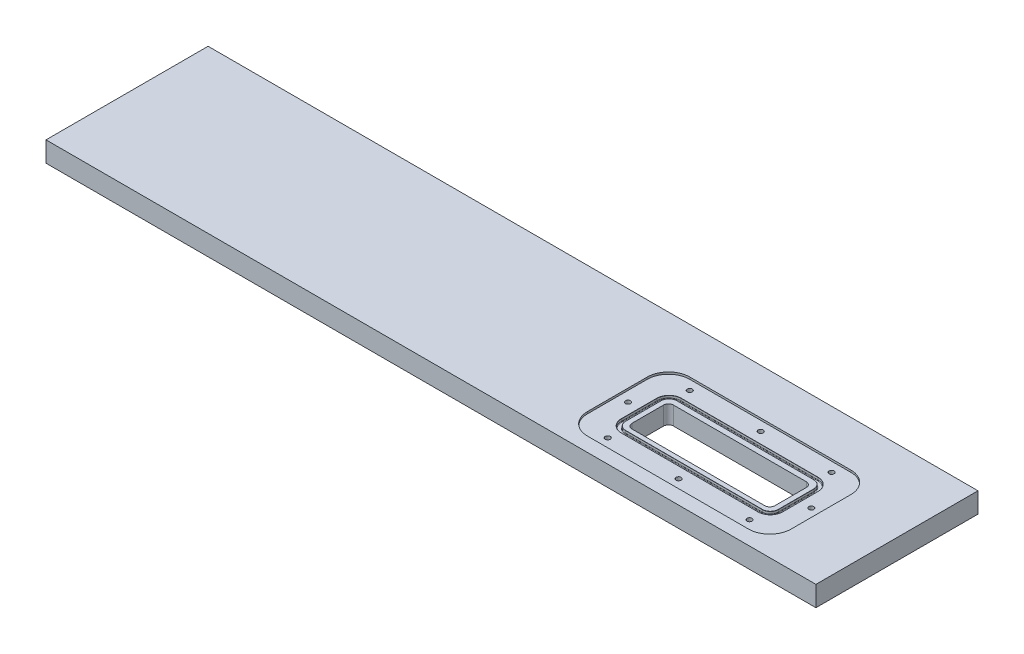
from build123d import *

# Parameters (mm, degrees)
SKETCH_1_W                  = 760
SKETCH_1_H                  = 160
EXTRUDE_1_DEPTH             = 10
SKETCH_2_R                  = 19
CUT_EXTRUDE_1_DEPTH         = 777.916983982
CUT_EXTRUDE_2_DEPTH         = 2
CUT_EXTRUDE_4_DEPTH         = 2.7
CUT_EXTRUDE_5_DEPTH         = 777.868071168
HOLE_WIZARD_M6_1_AT_2_COUNT = 2
HOLE_WIZARD_M6_1_AT_2_PITCH = 70
HOLE_WIZARD_M6_1_AT_3_COUNT = 2
HOLE_WIZARD_M6_1_AT_3_PITCH = 140
HOLE_WIZARD_M6_1_AT_4_COUNT = 2
HOLE_WIZARD_M6_1_AT_4_PITCH = 161.743624295
HOLE_WIZARD_M6_1_AT_5_COUNT = 2
HOLE_WIZARD_M6_1_AT_5_PITCH = 107.056060081
HOLE_WIZARD_M6_1_AT_6_COUNT = 2
HOLE_WIZARD_M6_1_AT_6_PITCH = 81
HOLE_WIZARD_M6_1_AT_7_COUNT = 2
HOLE_WIZARD_M6_1_AT_7_PITCH = 45.392730696
HOLE_WIZARD_M6_1_AT_8_COUNT = 2
HOLE_WIZARD_M6_1_AT_8_PITCH = 165.530963871
FILLET_1_R                  = 0.13
FILLET_2_R                  = 0.5
FILLET_3_R                  = 0.5
FILLET_4_R                  = 0.13
SKETCH_8_W                  = 211.597975829
SKETCH_8_H                  = 104.563980274
EXTRUDE_3_DEPTH             = 20
FILLET_1_OF_MIRROR_2_R      = 0.13
FILLET_2_OF_MIRROR_2_R      = 0.5
FILLET_3_OF_MIRROR_2_R      = 0.5
FILLET_4_OF_MIRROR_2_R      = 0.13
SKETCH_9_W                  = 824.574346591
SKETCH_9_H                  = 126.258075754
CUT_EXTRUDE_6_DEPTH         = 777.723889165


with BuildPart() as part:
    # 스케치1 → 보스-돌출1 (new, symmetric)
    with BuildSketch(Plane(origin=(0, 0, 0), x_dir=(1, 0, 0), z_dir=(0, 1, 0))):
        with Locations((380, 80)):
            Rectangle(SKETCH_1_W, SKETCH_1_H)
    extrude_1 = extrude(amount=EXTRUDE_1_DEPTH, both=True)

    # 스케치2 → 컷-돌출1 (cut, through all)
    with BuildSketch(Plane(origin=(0, 10, 0), x_dir=(1, 0, 0), z_dir=(0, 1, 0))):
        with Locations(Location((280, 80, 0), (0, 0, 270))):
            Circle(SKETCH_2_R)
        with Locations(Location((380, 80, 0), (0, 0, 270))):
            Circle(SKETCH_2_R)
    cut_extrude_1 = extrude(amount=-CUT_EXTRUDE_1_DEPTH, mode=Mode.SUBTRACT)

    # 스케치3 → 컷-돌출2 (cut)
    with BuildSketch(Plane(origin=(0, 10, 0), x_dir=(1, 0, 0), z_dir=(0, 1, 0))):
        with BuildLine():
            Line((520.5, 146), (679.5, 146))
            ThreePointArc((679.5, 146), (694.349242405, 139.849242405), (700.5, 125))
            Line((700.5, 125), (700.5, 66))
            ThreePointArc((700.5, 66), (694.349242405, 51.150757595), (679.5, 45))
            Line((679.5, 45), (520.5, 45))
            ThreePointArc((520.5, 45), (505.650757595, 51.150757595), (499.5, 66))
            Line((499.5, 66), (499.5, 125))
            ThreePointArc((499.5, 125), (505.650757595, 139.849242405), (520.5, 146))
        make_face()
    cut_extrude_2 = extrude(amount=-CUT_EXTRUDE_2_DEPTH, mode=Mode.SUBTRACT)

    # 스케치4 → 컷-돌출4 (cut)
    with BuildSketch(Plane(origin=(0, 8, 0), x_dir=(1, 0, 0), z_dir=(0, 1, 0))):
        with BuildLine():
            Line((532.5, 124.55), (667.5, 124.55))
            ThreePointArc((667.5, 124.55), (676.020636713, 121.020636713), (679.55, 112.5))
            Line((679.55, 112.5), (679.55, 77.5))
            ThreePointArc((679.55, 77.5), (676.020636713, 68.979363287), (667.5, 65.45))
            Line((667.5, 65.45), (532.5, 65.45))
            ThreePointArc((532.5, 65.45), (523.979363287, 68.979363287), (520.45, 77.5))
            Line((520.45, 77.5), (520.45, 112.5))
            ThreePointArc((520.45, 112.5), (523.979363287, 121.020636713), (532.5, 124.55))
        make_face()
        with BuildLine():
            Line((532.5, 120.45), (667.5, 120.45))
            ThreePointArc((667.5, 120.45), (673.12149891, 118.12149891), (675.45, 112.5))
            Line((675.45, 112.5), (675.45, 77.5))
            ThreePointArc((675.45, 77.5), (673.12149891, 71.87850109), (667.5, 69.55))
            Line((667.5, 69.55), (532.5, 69.55))
            ThreePointArc((532.5, 69.55), (526.87850109, 71.87850109), (524.55, 77.5))
            Line((524.55, 77.5), (524.55, 112.5))
            ThreePointArc((524.55, 112.5), (526.87850109, 118.12149891), (532.5, 120.45))
        make_face(mode=Mode.SUBTRACT)
    cut_extrude_4 = extrude(amount=-CUT_EXTRUDE_4_DEPTH, mode=Mode.SUBTRACT)

    # 스케치5 → 컷-돌출5 (cut, through all)
    with BuildSketch(Plane(origin=(0, 8, 0), x_dir=(1, 0, 0), z_dir=(0, 1, 0))):
        with BuildLine():
            Line((534.5, 116), (665.5, 116))
            ThreePointArc((665.5, 116), (669.035533906, 114.535533906), (670.5, 111))
            Line((670.5, 111), (670.5, 80))
            ThreePointArc((670.5, 80), (669.035533906, 76.464466094), (665.5, 75))
            Line((665.5, 75), (534.5, 75))
            ThreePointArc((534.5, 75), (530.964466094, 76.464466094), (529.5, 80))
            Line((529.5, 80), (529.5, 111))
            ThreePointArc((529.5, 111), (530.964466094, 114.535533906), (534.5, 116))
        make_face()
    cut_extrude_5 = extrude(amount=-CUT_EXTRUDE_5_DEPTH, mode=Mode.SUBTRACT)

    # 스케치7 → M6 나사 구멍1 (revolve, cut)
    with BuildSketch(Plane(origin=(530, 8, -135.5), x_dir=(0, 0, 1), z_dir=(1, 0, 0))):
        Polygon((0, 0), (0, 16.502151548), (2.5, 15), (2.5, 0), align=None)
    hole_wizard_m6_1 = revolve(axis=Axis((530, 14.35, -135.5), (0, -1, 0)), mode=Mode.SUBTRACT)

    # M6 나사 구멍1 at 2: M6 나사 구멍1 ×2
    with Locations(*[(i * HOLE_WIZARD_M6_1_AT_2_PITCH, 0, 0) for i in range(1, HOLE_WIZARD_M6_1_AT_2_COUNT)]):
        add(hole_wizard_m6_1, mode=Mode.SUBTRACT)

    # M6 나사 구멍1 at 3: M6 나사 구멍1 ×2
    with Locations(*[(i * HOLE_WIZARD_M6_1_AT_3_PITCH, 0, 0) for i in range(1, HOLE_WIZARD_M6_1_AT_3_COUNT)]):
        add(hole_wizard_m6_1, mode=Mode.SUBTRACT)

    # M6 나사 구멍1 at 4: M6 나사 구멍1 ×2
    with Locations(*[Vector(0.8655673483912874, 0, 0.5007925372835301) * (i * HOLE_WIZARD_M6_1_AT_4_PITCH) for i in range(1, HOLE_WIZARD_M6_1_AT_4_COUNT)]):
        add(hole_wizard_m6_1, mode=Mode.SUBTRACT)

    # M6 나사 구멍1 at 5: M6 나사 구멍1 ×2
    with Locations(*[Vector(0.6538630316419342, 0, 0.7566129366142368) * (i * HOLE_WIZARD_M6_1_AT_5_PITCH) for i in range(1, HOLE_WIZARD_M6_1_AT_5_COUNT)]):
        add(hole_wizard_m6_1, mode=Mode.SUBTRACT)

    # M6 나사 구멍1 at 6: M6 나사 구멍1 ×2
    with Locations(*[(0, 0, i * HOLE_WIZARD_M6_1_AT_6_PITCH) for i in range(1, HOLE_WIZARD_M6_1_AT_6_COUNT)]):
        add(hole_wizard_m6_1, mode=Mode.SUBTRACT)

    # M6 나사 구멍1 at 7: M6 나사 구멍1 ×2
    with Locations(*[Vector(-0.45161416125166726, 0, 0.8922133429606134) * (i * HOLE_WIZARD_M6_1_AT_7_PITCH) for i in range(1, HOLE_WIZARD_M6_1_AT_7_COUNT)]):
        add(hole_wizard_m6_1, mode=Mode.SUBTRACT)

    # M6 나사 구멍1 at 8: M6 나사 구멍1 ×2
    with Locations(*[Vector(0.9696071130550645, 0, 0.24466721544380116) * (i * HOLE_WIZARD_M6_1_AT_8_PITCH) for i in range(1, HOLE_WIZARD_M6_1_AT_8_COUNT)]):
        add(hole_wizard_m6_1, mode=Mode.SUBTRACT)

    # 필렛1
    fillet_1_edges = [part.edges().sort_by_distance(p)[0] for p in [
        (523.979363287, 8, -121.020636713),
        (520.45, 8, -95),
        (523.979363287, 8, -68.979363287),
        (600, 8, -65.45),
        (676.020636713, 8, -68.979363287),
        (679.55, 8, -95),
        (676.020636713, 8, -121.020636713),
        (600, 8, -124.55),
    ]]
    fillet(fillet_1_edges, radius=FILLET_1_R)

    # 필렛2
    fillet_2_edges = [part.edges().sort_by_distance(p)[0] for p in [
        (523.979363287, 5.3, -121.020636713),
        (600, 5.3, -124.55),
        (676.020636713, 5.3, -121.020636713),
        (679.55, 5.3, -95),
        (676.020636713, 5.3, -68.979363287),
        (600, 5.3, -65.45),
        (523.979363287, 5.3, -68.979363287),
        (520.45, 5.3, -95),
    ]]
    fillet(fillet_2_edges, radius=FILLET_2_R)

    # 필렛3
    fillet_3_edges = [part.edges().sort_by_distance(p)[0] for p in [
        (675.45, 5.3, -95),
        (673.12149891, 5.3, -118.12149891),
        (600, 5.3, -120.45),
        (526.87850109, 5.3, -118.12149891),
        (524.55, 5.3, -95),
        (526.87850109, 5.3, -71.87850109),
        (600, 5.3, -69.55),
        (673.12149891, 5.3, -71.87850109),
    ]]
    fillet(fillet_3_edges, radius=FILLET_3_R)

    # 필렛4
    fillet_4_edges = [part.edges().sort_by_distance(p)[0] for p in [
        (673.12149891, 8, -118.12149891),
        (675.45, 8, -95),
        (673.12149891, 8, -71.87850109),
        (600, 8, -69.55),
        (526.87850109, 8, -71.87850109),
        (524.55, 8, -95),
        (526.87850109, 8, -118.12149891),
        (600, 8, -120.45),
    ]]
    fillet(fillet_4_edges, radius=FILLET_4_R)

    # 스케치8 → 보스-돌출3 (add)
    with BuildSketch(Plane(origin=(0, 10, 0), x_dir=(1, 0, 0), z_dir=(0, 1, 0))):
        with Locations((324.424656153, 80)):
            Rectangle(SKETCH_8_W, SKETCH_8_H)
    extrude_3 = extrude(amount=-EXTRUDE_3_DEPTH)

    # 대칭 복사2: 보스-돌출1, 컷-돌출1, 컷-돌출2, 컷-돌출4, 컷-돌출5, M6 나사 구멍1, 보스-돌출3 across Front Plane
    add(extrude_1.mirror(Plane.XY))
    add(cut_extrude_1.mirror(Plane.XY), mode=Mode.SUBTRACT)
    add(cut_extrude_2.mirror(Plane.XY), mode=Mode.SUBTRACT)
    add(cut_extrude_4.mirror(Plane.XY), mode=Mode.SUBTRACT)
    add(cut_extrude_5.mirror(Plane.XY), mode=Mode.SUBTRACT)
    add(hole_wizard_m6_1.mirror(Plane.XY), mode=Mode.SUBTRACT)
    add(extrude_3.mirror(Plane.XY))

    # 대칭 복사2 copy 1 sketch → 대칭 복사2 copy 1 (revolve, cut)
    with BuildSketch(Plane(origin=(600, 8, 135.5), x_dir=(0, 0, -1), z_dir=(1, 0, 0))):
        Polygon((0, 0), (0, -16.502151548), (2.5, -15), (2.5, 0), align=None)
    revolve(axis=Axis((600, 14.35, 135.5), (0, 1, 0)), mode=Mode.SUBTRACT)

    # 대칭 복사2 copy 2 sketch → 대칭 복사2 copy 2 (revolve, cut)
    with BuildSketch(Plane(origin=(670, 8, 135.5), x_dir=(0, 0, -1), z_dir=(1, 0, 0))):
        Polygon((0, 0), (0, -16.502151548), (2.5, -15), (2.5, 0), align=None)
    revolve(axis=Axis((670, 14.35, 135.5), (0, 1, 0)), mode=Mode.SUBTRACT)

    # 대칭 복사2 copy 3 sketch → 대칭 복사2 copy 3 (revolve, cut)
    with BuildSketch(Plane(origin=(670, 8, 54.5), x_dir=(0, 0, -1), z_dir=(1, 0, 0))):
        Polygon((0, 0), (0, -16.502151548), (2.5, -15), (2.5, 0), align=None)
    revolve(axis=Axis((670, 14.35, 54.5), (0, 1, 0)), mode=Mode.SUBTRACT)

    # 대칭 복사2 copy 4 sketch → 대칭 복사2 copy 4 (revolve, cut)
    with BuildSketch(Plane(origin=(600, 8, 54.5), x_dir=(0, 0, -1), z_dir=(1, 0, 0))):
        Polygon((0, 0), (0, -16.502151548), (2.5, -15), (2.5, 0), align=None)
    revolve(axis=Axis((600, 14.35, 54.5), (0, 1, 0)), mode=Mode.SUBTRACT)

    # 대칭 복사2 copy 5 sketch → 대칭 복사2 copy 5 (revolve, cut)
    with BuildSketch(Plane(origin=(530, 8, 54.5), x_dir=(0, 0, -1), z_dir=(1, 0, 0))):
        Polygon((0, 0), (0, -16.502151548), (2.5, -15), (2.5, 0), align=None)
    revolve(axis=Axis((530, 14.35, 54.5), (0, 1, 0)), mode=Mode.SUBTRACT)

    # 대칭 복사2 copy 6 sketch → 대칭 복사2 copy 6 (revolve, cut)
    with BuildSketch(Plane(origin=(509.5, 8, 95), x_dir=(0, 0, -1), z_dir=(1, 0, 0))):
        Polygon((0, 0), (0, -16.502151548), (2.5, -15), (2.5, 0), align=None)
    revolve(axis=Axis((509.5, 14.35, 95), (0, 1, 0)), mode=Mode.SUBTRACT)

    # 대칭 복사2 copy 7 sketch → 대칭 복사2 copy 7 (revolve, cut)
    with BuildSketch(Plane(origin=(690.5, 8, 95), x_dir=(0, 0, -1), z_dir=(1, 0, 0))):
        Polygon((0, 0), (0, -16.502151548), (2.5, -15), (2.5, 0), align=None)
    revolve(axis=Axis((690.5, 14.35, 95), (0, 1, 0)), mode=Mode.SUBTRACT)

    # 필렛1 of 대칭 복사2
    fillet_1_of_mirror_2_edges = [part.edges().sort_by_distance(p)[0] for p in [
        (523.979363287, 8, 121.020636713),
        (520.45, 8, 95),
        (523.979363287, 8, 68.979363287),
        (600, 8, 65.45),
        (676.020636713, 8, 68.979363287),
        (679.55, 8, 95),
        (676.020636713, 8, 121.020636713),
        (600, 8, 124.55),
    ]]
    fillet(fillet_1_of_mirror_2_edges, radius=FILLET_1_OF_MIRROR_2_R)

    # 필렛2 of 대칭 복사2
    fillet_2_of_mirror_2_edges = [part.edges().sort_by_distance(p)[0] for p in [
        (523.979363287, 5.3, 121.020636713),
        (600, 5.3, 124.55),
        (676.020636713, 5.3, 121.020636713),
        (679.55, 5.3, 95),
        (676.020636713, 5.3, 68.979363287),
        (600, 5.3, 65.45),
        (523.979363287, 5.3, 68.979363287),
        (520.45, 5.3, 95),
    ]]
    fillet(fillet_2_of_mirror_2_edges, radius=FILLET_2_OF_MIRROR_2_R)

    # 필렛3 of 대칭 복사2
    fillet_3_of_mirror_2_edges = [part.edges().sort_by_distance(p)[0] for p in [
        (675.45, 5.3, 95),
        (673.12149891, 5.3, 118.12149891),
        (600, 5.3, 120.45),
        (526.87850109, 5.3, 118.12149891),
        (524.55, 5.3, 95),
        (526.87850109, 5.3, 71.87850109),
        (600, 5.3, 69.55),
        (673.12149891, 5.3, 71.87850109),
    ]]
    fillet(fillet_3_of_mirror_2_edges, radius=FILLET_3_OF_MIRROR_2_R)

    # 필렛4 of 대칭 복사2
    fillet_4_of_mirror_2_edges = [part.edges().sort_by_distance(p)[0] for p in [
        (673.12149891, 8, 118.12149891),
        (675.45, 8, 95),
        (673.12149891, 8, 71.87850109),
        (600, 8, 69.55),
        (526.87850109, 8, 71.87850109),
        (524.55, 8, 95),
        (526.87850109, 8, 118.12149891),
        (600, 8, 120.45),
    ]]
    fillet(fillet_4_of_mirror_2_edges, radius=FILLET_4_OF_MIRROR_2_R)

    # 스케치9 → 컷-돌출6 (cut, through all)
    with BuildSketch(Plane.XY):
        with Locations((395.691684997, -14.150794121)):
            Rectangle(SKETCH_9_W, SKETCH_9_H)
    extrude(amount=-CUT_EXTRUDE_6_DEPTH, mode=Mode.SUBTRACT)


solid = part.part
